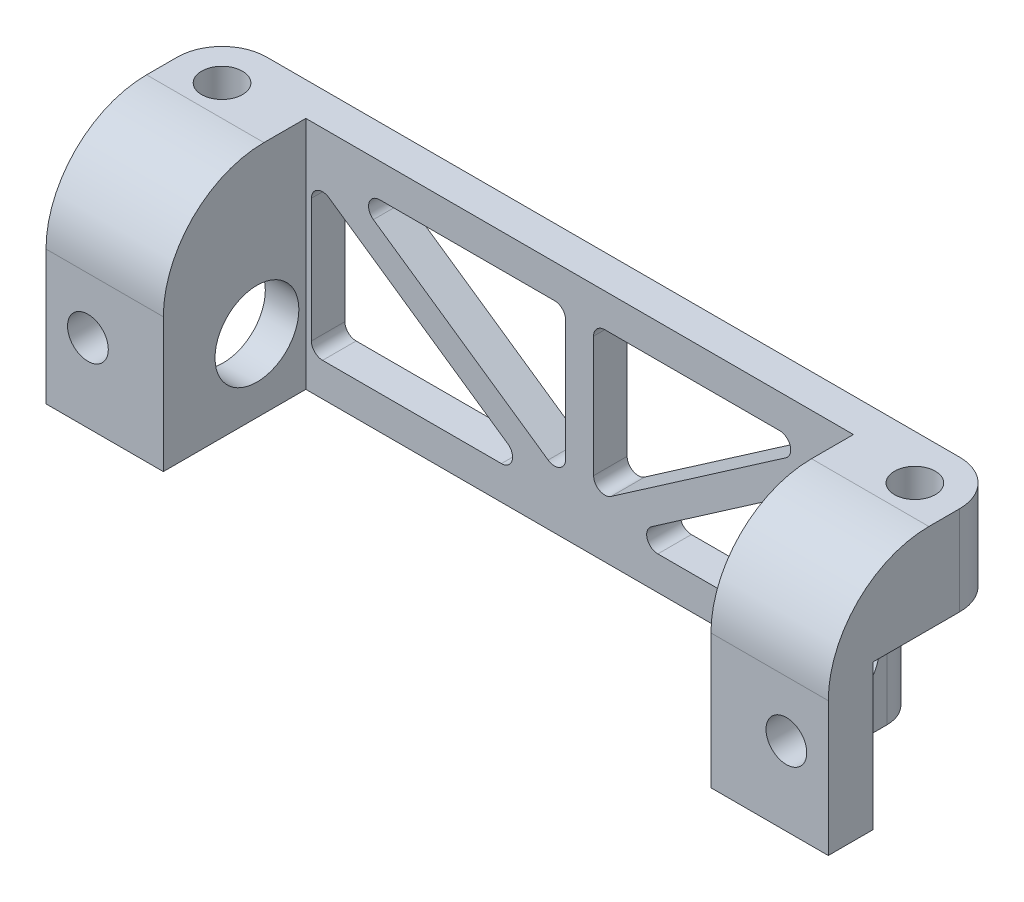
from build123d import *

# Parameters (mm, degrees)
BOSS_EXTRUDE1_DEPTH  = 21
SKETCH2_R            = 1.825
CUT_EXTRUDE1_DEPTH   = 4
SKETCH3_W            = 7.5
SKETCH3_H            = 11.75
CUT_EXTRUDE2_DEPTH   = 13
FILLET1_R            = 4
SKETCH5_R            = 1.825
CUT_EXTRUDE3_DEPTH   = 41.522370365
FILLET1_OF_MIRROR1_R = 4
CUT_EXTRUDE5_DEPTH   = 44.75
FILLET2_R            = 1
FILLET3_R            = 9
FILLET4_R            = 3
SKETCH11_R           = 3.75
CUT_EXTRUDE6_DEPTH   = 68.788734315


with BuildPart() as part:
    # Sketch1 → Boss-Extrude1 (new body)
    with BuildSketch(Plane(origin=(0, 0, 0), x_dir=(1, 0, 0), z_dir=(0, 1, 0))):
        Polygon((-24.5, 0), (-24.5, 12.75), (0, 12.75), (0, 15.75), (-35, 15.75), (-35, 0), align=None)
    boss_extrude1 = extrude(amount=BOSS_EXTRUDE1_DEPTH)

    # Sketch2 → Cut-Extrude1 (cut)
    with BuildSketch(Plane.XY):
        with Locations((-31.25, 7)):
            Circle(SKETCH2_R)
    cut_extrude1 = extrude(amount=-CUT_EXTRUDE1_DEPTH, mode=Mode.SUBTRACT)

    # Sketch3 → Cut-Extrude2 (cut)
    with BuildSketch(Plane.XZ):
        with Locations((-31.25, -9.875)):
            Rectangle(SKETCH3_W, SKETCH3_H)
    cut_extrude2 = extrude(amount=-CUT_EXTRUDE2_DEPTH, mode=Mode.SUBTRACT)

    # Fillet1
    fillet1_edges = [part.edges().sort_by_distance(p)[0] for p in [
        (-35, 17, -15.75),
    ]]
    fillet(fillet1_edges, radius=FILLET1_R)

    # Sketch5 → Cut-Extrude3 (cut, through all)
    with BuildSketch(Plane.XZ.offset(-13)):
        with Locations(Location((-31, -11.75, 0), (0, 0, 270))):
            Circle(SKETCH5_R)
    cut_extrude3 = extrude(amount=-CUT_EXTRUDE3_DEPTH, mode=Mode.SUBTRACT)

    # Mirror1: Boss-Extrude1, Cut-Extrude1, Cut-Extrude2, Cut-Extrude3 across plane
    add(boss_extrude1.mirror(Plane(origin=(0, 21, 0), x_dir=(0, 0, 1), z_dir=(-1, 0, 0))))
    add(cut_extrude1.mirror(Plane(origin=(0, 21, 0), x_dir=(0, 0, 1), z_dir=(-1, 0, 0))), mode=Mode.SUBTRACT)
    add(cut_extrude2.mirror(Plane(origin=(0, 21, 0), x_dir=(0, 0, 1), z_dir=(-1, 0, 0))), mode=Mode.SUBTRACT)
    add(cut_extrude3.mirror(Plane(origin=(0, 21, 0), x_dir=(0, 0, 1), z_dir=(-1, 0, 0))), mode=Mode.SUBTRACT)

    # Fillet1 of Mirror1
    fillet1_of_mirror1_edges = [part.edges().sort_by_distance(p)[0] for p in [
        (35, 17, -15.75),
    ]]
    fillet(fillet1_of_mirror1_edges, radius=FILLET1_OF_MIRROR1_R)

    # Sketch10 → Cut-Extrude5 (cut, through all)
    with BuildSketch(Plane(origin=(0, 0, -15.75), x_dir=(-1, 0, 0), z_dir=(0, 0, -1))):
        Polygon((-24, 3), (-3.793861182, 3), (-24, 16.969897852), align=None)
        Polygon((-21.093861182, 18), (-1.25, 18), (-1.25, 4.280569672), align=None)
        Polygon((24, 3), (24, 16.969897852), (3.793861182, 3), align=None)
        Polygon((21.093861182, 18), (1.25, 4.280569672), (1.25, 18), align=None)
    extrude(amount=-CUT_EXTRUDE5_DEPTH, mode=Mode.SUBTRACT)

    # Fillet2
    fillet2_edges = [part.edges().sort_by_distance(p)[0] for p in [
        (-24, 3, -14.25),
        (-3.793861182, 3, -14.25),
        (-24, 16.969897852, -14.25),
        (24, 3, -14.25),
        (24, 16.969897852, -14.25),
        (3.793861182, 3, -14.25),
        (-1.25, 18, -14.25),
        (-21.093861182, 18, -14.25),
        (-1.25, 4.280569672, -14.25),
        (1.25, 4.280569672, -14.25),
        (21.093861182, 18, -14.25),
        (1.25, 18, -14.25),
    ]]
    fillet(fillet2_edges, radius=FILLET2_R)

    # Fillet3
    fillet3_edges = [part.edges().sort_by_distance(p)[0] for p in [
        (-29.75, 21, 0),
        (29.75, 21, 0),
    ]]
    fillet(fillet3_edges, radius=FILLET3_R)

    # Fillet4
    fillet4_edges = [part.edges().sort_by_distance(p)[0] for p in [
        (-27.5, 6.5, -15.75),
        (27.5, 6.5, -15.75),
    ]]
    fillet(fillet4_edges, radius=FILLET4_R)

    # Sketch11 → Cut-Extrude6 (cut, through all)
    with BuildSketch(Plane(origin=(27.5, 0, 0), x_dir=(0, 0, -1), z_dir=(1, 0, 0))):
        with Locations((8.375, 6.5)):
            Circle(SKETCH11_R)
    extrude(amount=-CUT_EXTRUDE6_DEPTH, mode=Mode.SUBTRACT)


solid = part.part
